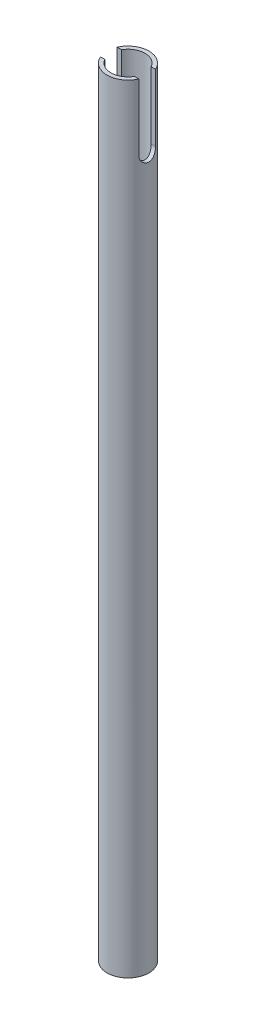
from build123d import *

# Parameters (mm, degrees)
SKETCH1_R               = 7.9375
SKETCH1_R_2             = 6.4643
BOSS_EXTRUDE1_DEPTH     = 295.474372219
CUT_EXTRUDE1_DEPTH      = 296.687525017
CUT_EXTRUDE1_DEPTH_BACK = 296.687525017


with BuildPart() as part:
    # Sketch1 → Boss-Extrude1 (new body)
    with BuildSketch(Plane(origin=(0, 0, 0), x_dir=(1, 0, 0), z_dir=(0, 1, 0))):
        with Locations(Location((0, 0, 0), (0, 0, 270))):
            Circle(SKETCH1_R)
        with Locations(Location((0, 0, 0), (0, 0, 270))):
            Circle(SKETCH1_R_2, mode=Mode.SUBTRACT)
    extrude(amount=BOSS_EXTRUDE1_DEPTH)

    # Sketch4 → Cut-Extrude1 (cut, two sides: drawn at the far end of the back side and taken through both)
    with BuildSketch(Plane(origin=(0, 0, 0), x_dir=(0, 0, -1), z_dir=(1, 0, 0)).offset(-CUT_EXTRUDE1_DEPTH_BACK)):
        with BuildLine():
            Line((3.175, 320.874372219), (3.175, 270.074372219))
            ThreePointArc((3.175, 270.074372219), (0, 266.899372219), (-3.175, 270.074372219))
            Line((-3.175, 270.074372219), (-3.175, 320.874372219))
            ThreePointArc((-3.175, 320.874372219), (0, 324.049372219), (3.175, 320.874372219))
        make_face()
    extrude(amount=CUT_EXTRUDE1_DEPTH + CUT_EXTRUDE1_DEPTH_BACK, mode=Mode.SUBTRACT)


solid = part.part
